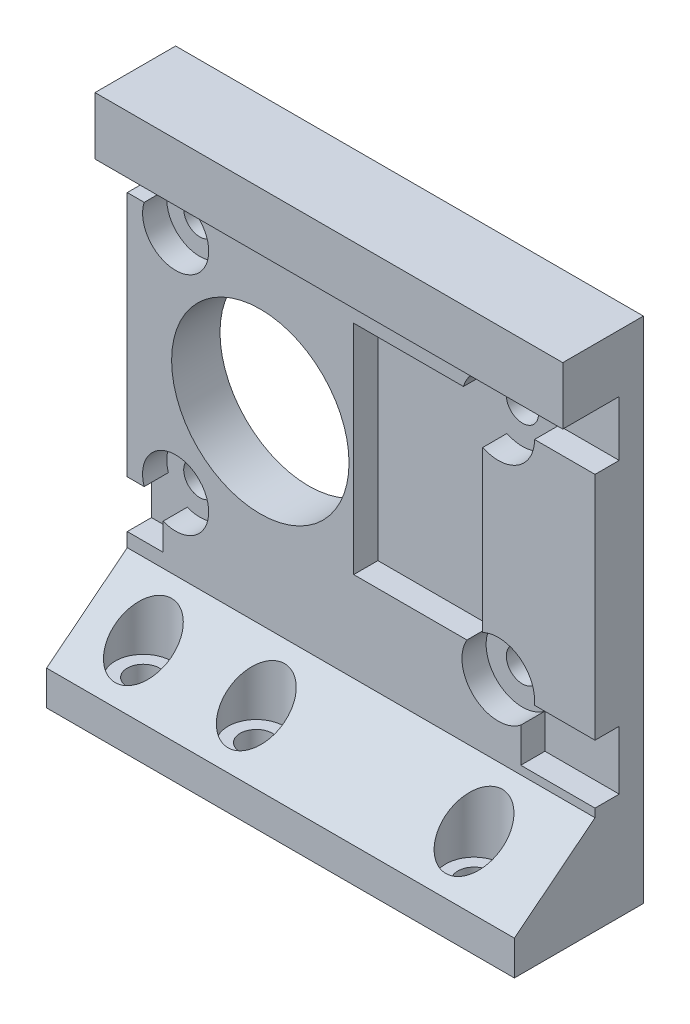
from build123d import *

# Parameters (mm, degrees)
SKETCH1_W            = 93
SKETCH1_H            = 100
BOSS_EXTRUDE2_DEPTH  = 10
SKETCH4_W            = 10.01
SKETCH4_H            = 15
BOSS_EXTRUDE4_DEPTH  = 24
SKETCH5_R            = 2
CUT_EXTRUDE1_DEPTH   = 50
SKETCH7_R            = 11
CUT_EXTRUDE3_DEPTH   = 50
SKETCH14_W           = 61.5
SKETCH14_H           = 42
CUT_EXTRUDE8_DEPTH   = 4
SKETCH19_R           = 11
CUT_EXTRUDE11_DEPTH  = 15
SKETCH20_R           = 2
CUT_EXTRUDE12_DEPTH  = 10
SKETCH21_W           = 40
SKETCH21_H           = 6
BOSS_EXTRUDE5_DEPTH  = 27
SKETCH22_W           = 40
SKETCH22_H           = 6.3
BOSS_EXTRUDE7_DEPTH  = 40
SKETCH23_R           = 8
CUT_EXTRUDE13_DEPTH  = 40
SKETCH24_W           = 118.277817783
SKETCH24_H           = 41.8
CUT_EXTRUDE14_DEPTH  = 40
SKETCH25_W           = 31.5
SKETCH25_H           = 23.2
CUT_EXTRUDE15_DEPTH  = 20
CUT_EXTRUDE18_DEPTH  = 3
SKETCH27_R           = 4.1
SKETCH27_R_2         = 4
CUT_EXTRUDE29_DEPTH  = 3
SKETCH28_W           = 29.5
SKETCH28_H           = 58.2
CUT_EXTRUDE30_DEPTH  = 23
SKETCH29_W           = 32
SKETCH29_H           = 4
CUT_EXTRUDE31_DEPTH  = 23
SKETCH31_W           = 32
SKETCH31_H           = 6
BOSS_EXTRUDE9_DEPTH  = 6.6
SKETCH32_W           = 32
SKETCH32_H           = 6
BOSS_EXTRUDE10_DEPTH = 10
SKETCH33_R           = 2
CUT_EXTRUDE32_DEPTH  = 10
BOSS_EXTRUDE11_START = -32
BOSS_EXTRUDE11_DEPTH = 32
SKETCH35_R           = 3.5
CUT_EXTRUDE33_DEPTH  = 10
SKETCH36_W           = 27
SKETCH36_H           = 46
CUT_EXTRUDE34_DEPTH  = 50
SKETCH38_W           = 31.75
SKETCH38_H           = 35
CUT_EXTRUDE35_DEPTH  = 50
SKETCH40_W           = 4
SKETCH40_H           = 77.818306413
CUT_EXTRUDE37_DEPTH  = 110
SKETCH41_W           = 28
SKETCH41_H           = 1.72
CUT_EXTRUDE38_DEPTH  = 50
BOSS_EXTRUDE12_DEPTH = 30
SKETCH43_R           = 2
CUT_EXTRUDE39_DEPTH  = 30
SKETCH44_R           = 4.5
CUT_EXTRUDE40_DEPTH  = 3
SKETCH45_W           = 9.206702729
SKETCH45_H           = 6.861074725
SKETCH45_H_2         = 7.289433521
CUT_EXTRUDE41_DEPTH  = 3
SKETCH46_W           = 16
SKETCH46_H           = 27
CUT_EXTRUDE42_DEPTH  = 3
SKETCH47_R           = 2
CUT_EXTRUDE43_DEPTH  = 3
SKETCH48_R           = 3.5
CUT_EXTRUDE44_DEPTH  = 23


with BuildPart() as part:
    # Sketch1 → Boss-Extrude2 (new body)
    with BuildSketch(Plane.XY):
        with Locations((-29.68705036, 14.928057554)):
            Rectangle(SKETCH1_W, SKETCH1_H)
    extrude(amount=BOSS_EXTRUDE2_DEPTH)

    # Sketch4 → Boss-Extrude4 (add)
    with BuildSketch(Plane(origin=(16.81294964, 0, 0), x_dir=(0, 0, -1), z_dir=(1, 0, 0))):
        with Locations((-4.995, -12.571942446)):
            Rectangle(SKETCH4_W, SKETCH4_H)
    extrude(amount=BOSS_EXTRUDE4_DEPTH)

    # Sketch5 → Cut-Extrude1 (cut)
    with BuildSketch(Plane(origin=(0, -5.071942446, 0), x_dir=(1, 0, 0), z_dir=(0, 1, 0))):
        with Locations(Location((26.81294964, -5, 0), (0, 0, 180))):
            Circle(SKETCH5_R)
    extrude(amount=-CUT_EXTRUDE1_DEPTH, mode=Mode.SUBTRACT)

    # Sketch7 → Cut-Extrude3 (cut)
    with BuildSketch(Plane(origin=(0, 0, 0), x_dir=(-1, 0, 0), z_dir=(0, 0, -1))):
        with Locations((24.18705036, 36.928057554)):
            Circle(SKETCH7_R)
    extrude(amount=-CUT_EXTRUDE3_DEPTH, mode=Mode.SUBTRACT)

    # Sketch14 → Cut-Extrude8 (cut)
    with BuildSketch(Plane.XY.offset(10)):
        with Locations((-13.93705036, 36.789132279)):
            Rectangle(SKETCH14_W, SKETCH14_H)
    extrude(amount=-CUT_EXTRUDE8_DEPTH, mode=Mode.SUBTRACT)

    # Sketch19 → Cut-Extrude11 (cut)
    with BuildSketch(Plane(origin=(0, 0, 0), x_dir=(-1, 0, 0), z_dir=(0, 0, -1))):
        with Locations((53.18705036, 36.928057554)):
            Circle(SKETCH19_R)
    extrude(amount=-CUT_EXTRUDE11_DEPTH, mode=Mode.SUBTRACT)

    # Sketch20 → Cut-Extrude12 (cut)
    with BuildSketch(Plane.XY.offset(6)):
        with Locations((-34.68705036, 50.928057554)):
            Circle(SKETCH20_R)
        with Locations((5.31294964, 50.928057554)):
            Circle(SKETCH20_R)
        with Locations((-34.68705036, 22.928057554)):
            Circle(SKETCH20_R)
        with Locations((5.31294964, 22.928057554)):
            Circle(SKETCH20_R)
    extrude(amount=-CUT_EXTRUDE12_DEPTH, mode=Mode.SUBTRACT)

    # Sketch21 → Boss-Extrude5 (add)
    with BuildSketch(Plane(origin=(0, 0, 0), x_dir=(-1, 0, 0), z_dir=(0, 0, -1))):
        with Locations((56.18705036, 61.928057554)):
            Rectangle(SKETCH21_W, SKETCH21_H)
    extrude(amount=BOSS_EXTRUDE5_DEPTH)

    # Sketch22 → Boss-Extrude7 (add)
    with BuildSketch(Plane.XZ.offset(-58.928057554)):
        with Locations((-56.18705036, -23.85)):
            Rectangle(SKETCH22_W, SKETCH22_H)
    extrude(amount=BOSS_EXTRUDE7_DEPTH)

    # Sketch23 → Cut-Extrude13 (cut)
    with BuildSketch(Plane.XY.offset(10)):
        with Locations((-53.18705036, 36.928057554)):
            Circle(SKETCH23_R)
    extrude(amount=-CUT_EXTRUDE13_DEPTH, mode=Mode.SUBTRACT)

    # Sketch24 → Cut-Extrude14 (cut)
    with BuildSketch(Plane.XY.offset(10)):
        with Locations((-17.048141468, -14.171942446)):
            Rectangle(SKETCH24_W, SKETCH24_H)
    extrude(amount=-CUT_EXTRUDE14_DEPTH, mode=Mode.SUBTRACT)

    # Sketch25 → Cut-Extrude15 (cut)
    with BuildSketch(Plane.XY.offset(10)):
        with Locations((-60.43705036, 18.328057554)):
            Rectangle(SKETCH25_W, SKETCH25_H)
    extrude(amount=-CUT_EXTRUDE15_DEPTH, mode=Mode.SUBTRACT)

    # Sketch26 → Cut-Extrude18 (cut)
    with BuildSketch(Plane.XY.offset(6)):
        with BuildLine():
            Line((14.30212304, 57.789132279), (6.863398886, 57.789132279))
            Line((6.863398886, 57.789132279), (6.863398886, 54.615347499))
            ThreePointArc((6.863398886, 54.615347499), (8.24773413, 53.645968516), (9.108195728, 52.191428892))
            Line((9.108195728, 52.191428892), (14.30212304, 52.191428892))
            Line((14.30212304, 52.191428892), (14.30212304, 57.789132279))
        make_face()
        with BuildLine():
            Line((6.863398886, 19.240767609), (6.863398886, 15.789132279))
            Line((6.863398886, 15.789132279), (14.30212304, 15.789132279))
            Line((14.30212304, 15.789132279), (14.30212304, 20.928057554))
            Line((14.30212304, 20.928057554), (8.777051255, 20.928057554))
            ThreePointArc((8.777051255, 20.928057554), (7.95835451, 19.927752057), (6.863398886, 19.240767609))
        make_face()
        with BuildLine():
            Line((-36.237499605, 57.789132279), (-44.68705036, 57.789132279))
            Line((-44.68705036, 57.789132279), (-44.68705036, 52.191428892))
            Line((-44.68705036, 52.191428892), (-38.482296447, 52.191428892))
            ThreePointArc((-38.482296447, 52.191428892), (-37.621834849, 53.645968516), (-36.237499605, 54.615347499))
            Line((-36.237499605, 54.615347499), (-36.237499605, 57.789132279))
        make_face()
        with BuildLine():
            Line((-44.68705036, 21.664686216), (-44.68705036, 15.789132279))
            Line((-44.68705036, 15.789132279), (-36.237499605, 15.789132279))
            Line((-36.237499605, 15.789132279), (-36.237499605, 19.240767609))
            ThreePointArc((-36.237499605, 19.240767609), (-37.621834849, 20.210146592), (-38.482296447, 21.664686216))
            Line((-38.482296447, 21.664686216), (-44.68705036, 21.664686216))
        make_face()
    extrude(amount=-CUT_EXTRUDE18_DEPTH, mode=Mode.SUBTRACT)

    # Sketch27 → Cut-Extrude29 (cut)
    with BuildSketch(Plane.XY.offset(6)):
        with Locations((5.31294964, 50.928057554)):
            Circle(SKETCH27_R)
        with Locations((5.31294964, 22.928057554)):
            Circle(SKETCH27_R_2)
        with Locations((-34.68705036, 50.928057554)):
            Circle(SKETCH27_R)
        with Locations((-34.68705036, 22.928057554)):
            Circle(SKETCH27_R)
    extrude(amount=-CUT_EXTRUDE29_DEPTH, mode=Mode.SUBTRACT)

    # Sketch28 → Cut-Extrude30 (cut)
    with BuildSketch(Plane(origin=(0, 0, 0), x_dir=(-1, 0, 0), z_dir=(0, 0, -1))):
        with Locations((-2.06294964, 35.828057554)):
            Rectangle(SKETCH28_W, SKETCH28_H)
    extrude(amount=-CUT_EXTRUDE30_DEPTH, mode=Mode.SUBTRACT)

    # Sketch29 → Cut-Extrude31 (cut)
    with BuildSketch(Plane(origin=(0, 15.789132279, 0), x_dir=(1, 0, 0), z_dir=(0, 1, 0))):
        with Locations((-28.68705036, -8)):
            Rectangle(SKETCH29_W, SKETCH29_H)
    extrude(amount=-CUT_EXTRUDE31_DEPTH, mode=Mode.SUBTRACT)

    # Sketch31 → Boss-Extrude9 (add)
    with BuildSketch(Plane.XZ.offset(-6.728057554)):
        with Locations((-28.68705036, 3)):
            Rectangle(SKETCH31_W, SKETCH31_H)
    extrude(amount=BOSS_EXTRUDE9_DEPTH)

    # Sketch32 → Boss-Extrude10 (add)
    with BuildSketch(Plane.XY.offset(6)):
        with Locations((-28.68705036, 3.128057554)):
            Rectangle(SKETCH32_W, SKETCH32_H)
    extrude(amount=BOSS_EXTRUDE10_DEPTH)

    # Sketch33 → Cut-Extrude32 (cut)
    with BuildSketch(Plane(origin=(0, 6.128057554, 0), x_dir=(1, 0, 0), z_dir=(0, 1, 0))):
        with Locations(Location((-33.68705036, -11, 0), (0, 0, 270))):
            Circle(SKETCH33_R)
        with Locations(Location((-19.68705036, -11, 0), (0, 0, 270))):
            Circle(SKETCH33_R)
    extrude(amount=-CUT_EXTRUDE32_DEPTH, mode=Mode.SUBTRACT)

    # Sketch34 → Boss-Extrude11 (add)
    with BuildSketch(Plane(origin=(-12.68705036, 0, 0), x_dir=(0, 0, -1), z_dir=(1, 0, 0)).offset(BOSS_EXTRUDE11_START)):
        Polygon((-16, 6.128057554), (-6, 6.128057554), (-6, 14.058360342), align=None)
    extrude(amount=BOSS_EXTRUDE11_DEPTH)

    # Sketch35 → Cut-Extrude33 (cut)
    with BuildSketch(Plane.XZ.offset(-6.128057554)):
        with Locations((-19.68705036, 11)):
            Circle(SKETCH35_R)
        with Locations((-33.68705036, 11)):
            Circle(SKETCH35_R)
    extrude(amount=-CUT_EXTRUDE33_DEPTH, mode=Mode.SUBTRACT)

    # Sketch36 → Cut-Extrude34 (cut)
    with BuildSketch(Plane(origin=(-36.18705036, 0, 0), x_dir=(0, 0, -1), z_dir=(1, 0, 0))):
        with Locations((13.5, 41.928057554)):
            Rectangle(SKETCH36_W, SKETCH36_H)
    extrude(amount=-CUT_EXTRUDE34_DEPTH, mode=Mode.SUBTRACT)

    # Sketch38 → Cut-Extrude35 (cut)
    with BuildSketch(Plane.XY.offset(10)):
        with Locations((-60.31205036, 47.428057554)):
            Rectangle(SKETCH38_W, SKETCH38_H)
    extrude(amount=-CUT_EXTRUDE35_DEPTH, mode=Mode.SUBTRACT)

    # Sketch40 → Cut-Extrude37 (cut)
    with BuildSketch(Plane.XY.offset(16)):
        with Locations((-42.68705036, 39.037210761)):
            Rectangle(SKETCH40_W, SKETCH40_H)
    extrude(amount=-CUT_EXTRUDE37_DEPTH, mode=Mode.SUBTRACT)

    # Sketch41 → Cut-Extrude38 (cut)
    with BuildSketch(Plane.XY.offset(16)):
        with Locations((-26.68705036, 0.988057554)):
            Rectangle(SKETCH41_W, SKETCH41_H)
    extrude(amount=-CUT_EXTRUDE38_DEPTH, mode=Mode.SUBTRACT)

    # Sketch42 → Boss-Extrude12 (add)
    with BuildSketch(Plane(origin=(-12.68705036, 0, 0), x_dir=(0, 0, -1), z_dir=(1, 0, 0))):
        Polygon((-10, 64.928057554), (0, 64.928057554), (0, 1.848057554), (-16, 1.848057554), (-16, 6.128057554), (-6, 14.058360342), (-6, 57.789132279), (-10, 57.789132279), align=None)
    extrude(amount=BOSS_EXTRUDE12_DEPTH)

    # Sketch43 → Cut-Extrude39 (cut)
    with BuildSketch(Plane.XY.offset(6)):
        with Locations((5.31294964, 50.928057554)):
            Circle(SKETCH43_R)
        with Locations((5.31294964, 22.928057554)):
            Circle(SKETCH43_R)
    extrude(amount=-CUT_EXTRUDE39_DEPTH, mode=Mode.SUBTRACT)

    # Sketch44 → Cut-Extrude40 (cut)
    with BuildSketch(Plane.XY.offset(6)):
        with Locations((5.31294964, 22.928057554)):
            Circle(SKETCH44_R)
        with Locations((5.31294964, 50.928057554)):
            Circle(SKETCH44_R)
    extrude(amount=-CUT_EXTRUDE40_DEPTH, mode=Mode.SUBTRACT)

    # Sketch45 → Cut-Extrude41 (cut)
    with BuildSketch(Plane.XY.offset(6)):
        with Locations((12.709598275, 54.358594917)):
            Rectangle(SKETCH45_W, SKETCH45_H)
        with Locations((12.709598275, 18.736953601)):
            Rectangle(SKETCH45_W, SKETCH45_H_2)
    extrude(amount=-CUT_EXTRUDE41_DEPTH, mode=Mode.SUBTRACT)

    # Sketch46 → Cut-Extrude42 (cut)
    with BuildSketch(Plane.XY.offset(6)):
        with Locations((-4.607936524, 38.706325488)):
            Rectangle(SKETCH46_W, SKETCH46_H)
    extrude(amount=-CUT_EXTRUDE42_DEPTH, mode=Mode.SUBTRACT)

    # Sketch47 → Cut-Extrude43 (cut)
    with BuildSketch(Plane.XZ.offset(-1.848057554)):
        with Locations(Location((7.31294964, 11, 0), (0, 0, 270))):
            Circle(SKETCH47_R)
    extrude(amount=-CUT_EXTRUDE43_DEPTH, mode=Mode.SUBTRACT)

    # Sketch48 → Cut-Extrude44 (cut)
    with BuildSketch(Plane.XZ.offset(-4.848057554)):
        with Locations(Location((7.31294964, 11, 0), (0, 0, 270))):
            Circle(SKETCH48_R)
    extrude(amount=-CUT_EXTRUDE44_DEPTH, mode=Mode.SUBTRACT)


solid = part.part
